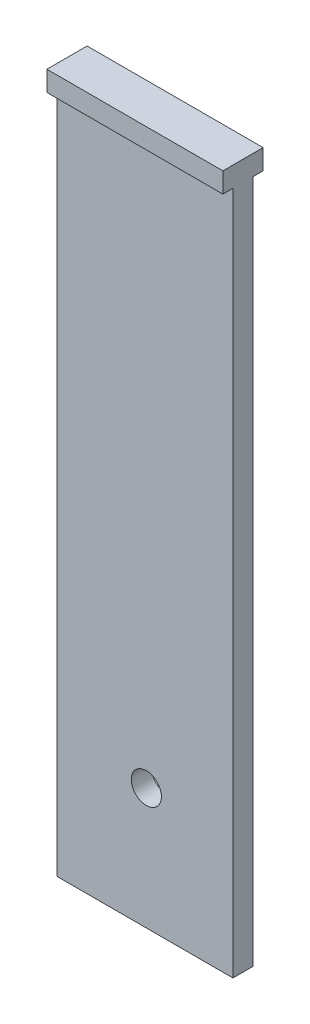
from build123d import *

# Parameters (mm, degrees)
SKETCH1_W           = 35
SKETCH1_H           = 140
SKETCH1_R           = 3
BOSS_EXTRUDE1_DEPTH = 4
SKETCH2_W           = 35
SKETCH2_H           = 8
BOSS_EXTRUDE2_DEPTH = 4


with BuildPart() as part:
    # Sketch1 → Boss-Extrude1 (new body)
    with BuildSketch(Plane.XY):
        Rectangle(SKETCH1_W, SKETCH1_H)
        with Locations((0.277177956, -45.903341346)):
            Circle(SKETCH1_R, mode=Mode.SUBTRACT)
    extrude(amount=BOSS_EXTRUDE1_DEPTH)

    # Sketch2 → Boss-Extrude2 (add)
    with BuildSketch(Plane(origin=(0, 70, 0), x_dir=(1, 0, 0), z_dir=(0, 1, 0))):
        with Locations((0, -2)):
            Rectangle(SKETCH2_W, SKETCH2_H)
    extrude(amount=-BOSS_EXTRUDE2_DEPTH)


solid = part.part
